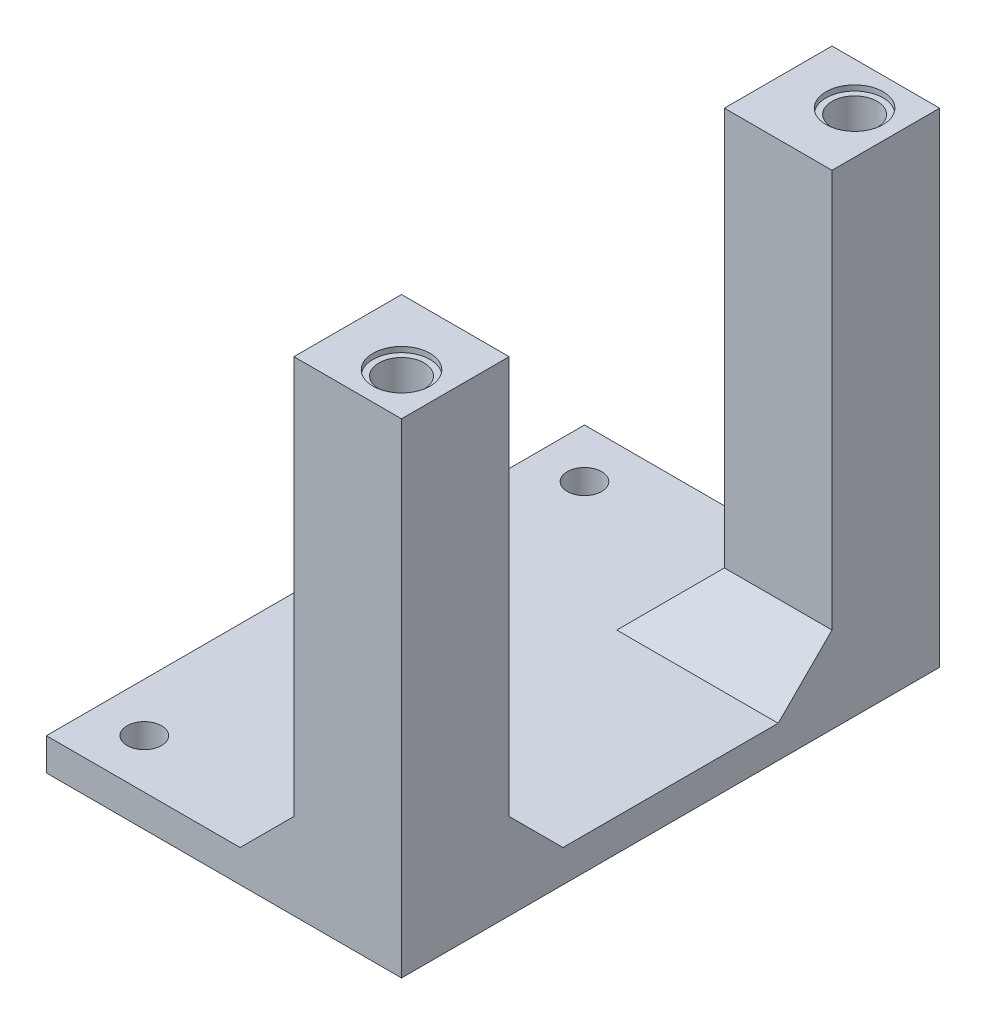
from build123d import *

# Parameters (mm, degrees)
SKETCH1_R           = 1.6
BOSS_EXTRUDE1_DEPTH = 3
SKETCH2_W           = 10
SKETCH2_H           = 10
BOSS_EXTRUDE2_DEPTH = 42
CHAMFER1_SIZE       = 5
SKETCH3_R           = 2.1
CUT_EXTRUDE1_DEPTH  = 52
SKETCH4_R           = 2.65
CUT_EXTRUDE2_DEPTH  = 0.5


with BuildPart() as part:
    # Sketch1 → Boss-Extrude1 (new body)
    with BuildSketch(Plane(origin=(0, 0, 0), x_dir=(1, 0, 0), z_dir=(0, 1, 0))):
        Polygon((-6.512396694, 9.685950413), (1.487603306, 9.685950413), (26.487603306, 9.685950413), (26.487603306, -40.314049587), (1.487603306, -40.314049587), (-6.512396694, -40.314049587), align=None)
        with Locations(Location((-1.962396694, -35.764049587, 0), (0, 0, 270))):
            Circle(SKETCH1_R, mode=Mode.SUBTRACT)
        with Locations(Location((-1.962396694, 5.135950413, 0), (0, 0, 270))):
            Circle(SKETCH1_R, mode=Mode.SUBTRACT)
    extrude(amount=BOSS_EXTRUDE1_DEPTH)

    # Sketch2 → Boss-Extrude2 (add)
    with BuildSketch(Plane(origin=(0, 3, 0), x_dir=(1, 0, 0), z_dir=(0, 1, 0))):
        with Locations((21.487603306, -35.314049587)):
            Rectangle(SKETCH2_W, SKETCH2_H)
        with Locations((21.487603306, 4.685950413)):
            Rectangle(SKETCH2_W, SKETCH2_H)
    extrude(amount=BOSS_EXTRUDE2_DEPTH)

    # Chamfer1
    chamfer1_edges = [part.edges().sort_by_distance(p)[0] for p in [
        (21.487603306, 3, 30.314049587),
        (16.487603306, 3, 35.314049587),
        (16.487603306, 3, -4.685950413),
        (21.487603306, 3, 0.314049587),
    ]]
    chamfer(chamfer1_edges, length=CHAMFER1_SIZE)

    # Sketch3 → Cut-Extrude1 (cut)
    with BuildSketch(Plane(origin=(0, 45, 0), x_dir=(1, 0, 0), z_dir=(0, 1, 0))):
        with Locations(Location((22.537603306, -36.364049587, 0), (0, 0, 270))):
            Circle(SKETCH3_R)
        with Locations(Location((22.537603306, 5.735950413, 0), (0, 0, 270))):
            Circle(SKETCH3_R)
    extrude(amount=-CUT_EXTRUDE1_DEPTH, mode=Mode.SUBTRACT)

    # Sketch4 → Cut-Extrude2 (cut)
    with BuildSketch(Plane(origin=(0, 45, 0), x_dir=(1, 0, 0), z_dir=(0, 1, 0))):
        with Locations(Location((22.537603306, -36.364049587, 0), (0, 0, 270))):
            Circle(SKETCH4_R)
        with Locations(Location((22.537603306, 5.735950413, 0), (0, 0, 270))):
            Circle(SKETCH4_R)
    cut_extrude2 = extrude(amount=-CUT_EXTRUDE2_DEPTH, mode=Mode.SUBTRACT)

    # Mirror1: Cut-Extrude2 across plane
    add(cut_extrude2.mirror(Plane(origin=(0, 22.5, 0), x_dir=(0, 0, 1), z_dir=(0, -1, 0))), mode=Mode.SUBTRACT)


solid = part.part
